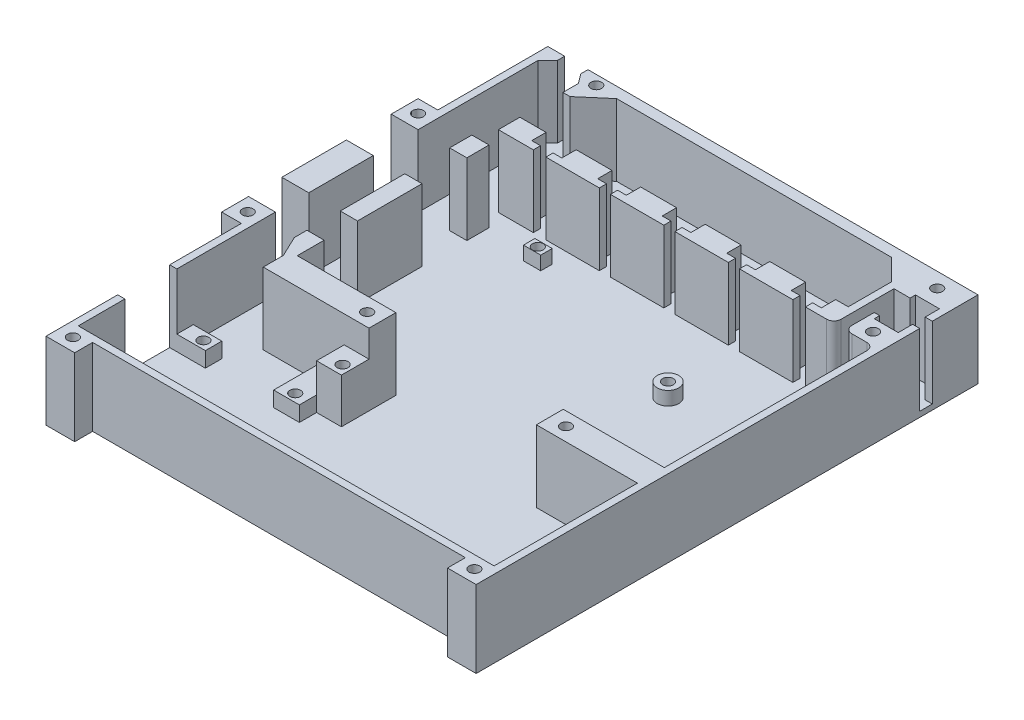
from build123d import *

# Parameters (mm, degrees)
BOSS_EXTRUDE1_DEPTH = 1.5
SKETCH2_W           = 4.8
SKETCH2_H           = 18
BOSS_EXTRUDE2_DEPTH = 20
SKETCH3_R           = 1.5
CUT_EXTRUDE1_DEPTH  = 20
SKETCH4_R           = 3
SKETCH4_R_2         = 1.5
SKETCH4_W           = 4.828517764
SKETCH4_H           = 3.2
SKETCH4_W_2         = 5.829541735
SKETCH4_H_2         = 5.702554953
SKETCH4_W_3         = 4.58984945
BOSS_EXTRUDE3_DEPTH = 3.8
SKETCH5_W           = 7.960049614
SKETCH5_H           = 4.589179968
SKETCH5_R           = 1.5
SKETCH5_W_2         = 8.506770289
SKETCH5_H_2         = 5.091999219
SKETCH5_W_3         = 7.172313144
SKETCH5_H_3         = 12.5
SKETCH5_H_4         = 13
BOSS_EXTRUDE4_DEPTH = 4.25
SKETCH6_W           = 6.917388718
SKETCH6_H           = 7.693263261
SKETCH6_R           = 1.5
SKETCH6_W_2         = 6.017640473
SKETCH6_H_2         = 7.169329529
BOSS_EXTRUDE5_DEPTH = 12.5


with BuildPart() as part:
    # Sketch1 → Boss-Extrude1 (new body)
    with BuildSketch(Plane(origin=(0, 0, 0), x_dir=(1, 0, 0), z_dir=(0, 1, 0))):
        Polygon((-60, -67.5), (-60, -72.5), (-52, -72.5), (-52, -67.5), (52, -67.5), (52, -72.5), (60, -72.5), (60, -67.5), (60, 67.5), (-60, 67.5), (-60, 36.8), (-65.5, 36.8), (-65.5, 29.3), (-60, 29.3), (-60, 16.8), (-65.5, 16.8), (-65.5, 7.8), (-65.5, -1.2), (-60, -1.2), (-60, -10.5), (-65.5, -10.5), (-65.5, -18), (-60, -18), align=None)
    extrude(amount=BOSS_EXTRUDE1_DEPTH)

    # Sketch2 → Boss-Extrude2 (add)
    with BuildSketch(Plane(origin=(0, 1.5, 0), x_dir=(1, 0, 0), z_dir=(0, 1, 0))):
        Polygon((-58, 62.8), (-58, 29.3), (-60, 29.3), (-65.5, 29.3), (-65.5, 36.8), (-60, 36.8), (-60, 67.5), (-55.3, 67.5), (-55.3, 65.5), align=None)
        with BuildLine():
            Line((-58, -65.5), (58, -65.5))
            Line((58, -65.5), (58, -25.5))
            Line((58, -25.5), (29.8, -25.5))
            Line((29.8, -25.5), (29.8, -18))
            Line((29.8, -18), (58, -18))
            Line((58, -18), (58, 38.5))
            ThreePointArc((58, 38.5), (57.414213562, 39.914213562), (56, 40.5))
            Line((56, 40.5), (51.8, 40.5))
            ThreePointArc((51.8, 40.5), (50.385786438, 41.085786438), (49.8, 42.5))
            Line((49.8, 42.5), (49.8, 48.75))
            Line((49.8, 48.75), (51.3, 48.75))
            Line((51.3, 48.75), (51.3, 47.25))
            Line((51.3, 47.25), (58, 47.25))
            Line((58, 47.25), (58, 51.25))
            Line((58, 51.25), (60, 51.25))
            Line((60, 51.25), (60, -72.5))
            Line((60, -72.5), (52, -72.5))
            Line((52, -72.5), (52, -67.5))
            Line((52, -67.5), (-52, -67.5))
            Line((-52, -67.5), (-52, -72.5))
            Line((-52, -72.5), (-60, -72.5))
            Line((-60, -72.5), (-60, -52.5))
            Line((-60, -52.5), (-58, -52.5))
            Line((-58, -52.5), (-58, -65.5))
        make_face()
        Polygon((-60, 16.8), (-58, 16.8), (-58, -1.2), (-60, -1.2), (-65.5, -1.2), (-65.5, 16.8), align=None)
        Polygon((-60, -10.5), (-58, -10.5), (-58, -38), (-60, -38), (-60, -18), (-65.5, -18), (-65.5, -10.5), align=None)
        with BuildLine():
            Line((-48.8, 67.5), (-48.8, 65.5))
            Line((-48.8, 65.5), (-46.8, 62.8))
            Line((-46.8, 62.8), (-46.8, 58.5))
            Line((-46.8, 58.5), (-44.8, 58.5))
            Line((-44.8, 58.5), (-37.8, 64.5))
            Line((-37.8, 64.5), (38.8, 64.5))
            Line((38.8, 64.5), (44.8, 58.5))
            Line((44.8, 58.5), (44.8, 46.5))
            Line((44.8, 46.5), (41.3, 46.5))
            Line((41.3, 46.5), (41.3, 42.5))
            Line((41.3, 42.5), (38.85, 42.5))
            Line((38.85, 42.5), (38.85, 40.5))
            Line((38.85, 40.5), (44.8, 40.5))
            ThreePointArc((44.8, 40.5), (46.214213562, 41.085786438), (46.8, 42.5))
            Line((46.8, 42.5), (46.8, 46.5))
            Line((46.8, 46.5), (46.8, 57.25))
            Line((46.8, 57.25), (51.3, 57.25))
            Line((51.3, 57.25), (51.3, 58.75))
            Line((51.3, 58.75), (58, 58.75))
            Line((58, 58.75), (58, 54.75))
            Line((58, 54.75), (60, 54.75))
            Line((60, 54.75), (60, 67.5))
            Line((60, 67.5), (-48.8, 67.5))
        make_face()
        Polygon((-46.8, 46.5), (-39.5, 46.5), (-39.5, 42.5), (-37.05, 42.5), (-37.05, 40.5), (-46.8, 40.5), align=None)
        Polygon((-33.55, 42.5), (-33.55, 40.5), (-18.65, 40.5), (-18.65, 42.5), (-21.1, 42.5), (-21.1, 46.5), (-31.1, 46.5), (-31.1, 42.5), align=None)
        Polygon((-15.55, 40.5), (-0.65, 40.5), (-0.65, 42.5), (-3.1, 42.5), (-3.1, 46.5), (-13.1, 46.5), (-13.1, 42.5), (-15.55, 42.5), align=None)
        Polygon((2.45, 40.5), (17.35, 40.5), (17.35, 42.5), (14.9, 42.5), (14.9, 46.5), (4.9, 46.5), (4.9, 42.5), (2.45, 42.5), align=None)
        Polygon((20.45, 40.5), (35.35, 40.5), (35.35, 42.5), (32.9, 42.5), (32.9, 46.5), (22.9, 46.5), (22.9, 42.5), (20.45, 42.5), align=None)
        Polygon((-46.8, 35.5), (-49.2, 35.5), (-49.2, 29.3), (-44.4, 29.3), (-44.4, 35.5), align=None)
        with Locations((-46.8, 7.8)):
            Rectangle(SKETCH2_W, SKETCH2_H)
        Polygon((-49.2, -10.5), (-44.4, -10.5), (-44.4, -18), (-16.9, -18), (-16.9, -25.5), (-46.4, -25.5), (-46.4, -19.9), (-49.2, -14), align=None)
    extrude(amount=BOSS_EXTRUDE2_DEPTH)

    # Sketch3 → Cut-Extrude1 (cut)
    with BuildSketch(Plane(origin=(0, 21.5, 0), x_dir=(1, 0, 0), z_dir=(0, 1, 0))):
        with Locations(Location((52.774715074, 63.354517547, 0), (0, 0, 270))):
            Circle(SKETCH3_R)
        with Locations(Location((-43.84271688, 64.854517547, 0), (0, 0, 270))):
            Circle(SKETCH3_R)
        with Locations(Location((-61.879270776, 33.191143968, 0), (0, 0, 270))):
            Circle(SKETCH3_R)
        with Locations(Location((-61.879270776, -14.337618299, 0), (0, 0, 270))):
            Circle(SKETCH3_R)
        with Locations(Location((54.274715074, 43.945098524, 0), (0, 0, 270))):
            Circle(SKETCH3_R)
        with Locations(Location((-21.029637868, -21.862387391, 0), (0, 0, 270))):
            Circle(SKETCH3_R)
        with Locations(Location((34.3, -21.75, 0), (0, 0, 270))):
            Circle(SKETCH3_R)
        with Locations(Location((-56, -69, 0), (0, 0, 270))):
            Circle(SKETCH3_R)
        with Locations(Location((56, -69, 0), (0, 0, 270))):
            Circle(SKETCH3_R)
    extrude(amount=-CUT_EXTRUDE1_DEPTH, mode=Mode.SUBTRACT)

    # Sketch4 → Boss-Extrude3 (add)
    # profile 1 of 5: a face of its own
    with BuildSketch(Plane(origin=(0, 1.5, 0), x_dir=(1, 0, 0), z_dir=(0, 1, 0))):
        with Locations(Location((21.544764921, -8.320497528, 0), (0, 0, 90))):
            Circle(SKETCH4_R)
        with Locations(Location((21.544764921, -8.320497528, 0), (0, 0, 90))):
            Circle(SKETCH4_R_2, mode=Mode.SUBTRACT)
    # profile 2 of 5: a face of its own
    with BuildSketch(Plane(origin=(0, 1.5, 0), x_dir=(1, 0, 0), z_dir=(0, 1, 0))):
        with Locations(Location((21.544764921, 19.479502472, 0), (0, 0, 90))):
            Circle(SKETCH4_R)
        with Locations(Location((21.544764921, 19.479502472, 0), (0, 0, 90))):
            Circle(SKETCH4_R_2, mode=Mode.SUBTRACT)
    # profile 3 of 5: a face of its own
    with BuildSketch(Plane(origin=(0, 1.5, 0), x_dir=(1, 0, 0), z_dir=(0, 1, 0))):
        with Locations((-29.2, 33.9)):
            Rectangle(SKETCH4_W, SKETCH4_H)
        with Locations(Location((-29.2, 33.9, 0), (0, 0, 90))):
            Circle(SKETCH4_R_2, mode=Mode.SUBTRACT)
    # profile 4 of 5: a face of its own
    with BuildSketch(Plane(origin=(0, 1.5, 0), x_dir=(1, 0, 0), z_dir=(0, 1, 0))):
        with Locations((-30.25253813, -15.148722524)):
            Rectangle(SKETCH4_W_2, SKETCH4_H_2)
        with Locations(Location((-30.3, -14.4, 0), (0, 0, 90))):
            Circle(SKETCH4_R_2, mode=Mode.SUBTRACT)
    # profile 5 of 5: a face of its own
    with BuildSketch(Plane(origin=(0, 1.5, 0), x_dir=(1, 0, 0), z_dir=(0, 1, 0))):
        with Locations((51.718864017, -15.148722524)):
            Rectangle(SKETCH4_W_3, SKETCH4_H_2)
        with Locations(Location((51.8, -14.4, 0), (0, 0, 90))):
            Circle(SKETCH4_R_2, mode=Mode.SUBTRACT)
    extrude(amount=BOSS_EXTRUDE3_DEPTH)

    # Sketch5 → Boss-Extrude4 (add)
    # profile 1 of 4: a face of its own
    with BuildSketch(Plane(origin=(0, 1.5, 0), x_dir=(1, 0, 0), z_dir=(0, 1, 0))):
        with Locations((-54.019975193, -35.705410016)):
            Rectangle(SKETCH5_W, SKETCH5_H)
        with Locations(Location((-52.773553759, -35.8, 0), (0, 0, 270))):
            Circle(SKETCH5_R, mode=Mode.SUBTRACT)
    # profile 2 of 4: a face of its own
    with BuildSketch(Plane(origin=(0, 1.5, 0), x_dir=(1, 0, 0), z_dir=(0, 1, 0))):
        with Locations((-53.746614856, -55.04599961)):
            Rectangle(SKETCH5_W_2, SKETCH5_H_2)
        with Locations(Location((-52.773553759, -54.7, 0), (0, 0, 270))):
            Circle(SKETCH5_R, mode=Mode.SUBTRACT)
    # profile 3 of 4: a face of its own
    with BuildSketch(Plane(origin=(0, 1.5, 0), x_dir=(1, 0, 0), z_dir=(0, 1, 0))):
        with Locations((-27.40354529, -31.75)):
            Rectangle(SKETCH5_W_3, SKETCH5_H_3)
        with Locations(Location((-27.173553759, -35.8, 0), (0, 0, 270))):
            Circle(SKETCH5_R, mode=Mode.SUBTRACT)
    # profile 4 of 4: a face of its own
    with BuildSketch(Plane(origin=(0, 1.5, 0), x_dir=(1, 0, 0), z_dir=(0, 1, 0))):
        with Locations((-27.40354529, -59)):
            Rectangle(SKETCH5_W_3, SKETCH5_H_4)
        with Locations(Location((-27.173553759, -54.7, 0), (0, 0, 270))):
            Circle(SKETCH5_R, mode=Mode.SUBTRACT)
    extrude(amount=BOSS_EXTRUDE4_DEPTH)

    # Sketch6 → Boss-Extrude5 (add)
    # profile 1 of 4: a face of its own
    with BuildSketch(Plane(origin=(0, 1.5, 0), x_dir=(1, 0, 0), z_dir=(0, 1, 0))):
        with Locations((-20.358694359, -29.346631631)):
            Rectangle(SKETCH6_W, SKETCH6_H)
        with Locations(Location((-19.26, -30.5, 0), (0, 0, 270))):
            Circle(SKETCH6_R, mode=Mode.SUBTRACT)
    # profile 2 of 4: a face of its own
    with BuildSketch(Plane(origin=(0, 1.5, 0), x_dir=(1, 0, 0), z_dir=(0, 1, 0))):
        with Locations((54.991179763, -29.346631631)):
            Rectangle(SKETCH6_W_2, SKETCH6_H)
        with Locations(Location((55.14, -30.5, 0), (0, 0, 270))):
            Circle(SKETCH6_R, mode=Mode.SUBTRACT)
    # profile 3 of 4: a face of its own
    with BuildSketch(Plane(origin=(0, 1.5, 0), x_dir=(1, 0, 0), z_dir=(0, 1, 0))):
        with Locations((54.991179763, -61.915335236)):
            Rectangle(SKETCH6_W_2, SKETCH6_H_2)
        with Locations(Location((55.14, -61.1, 0), (0, 0, 270))):
            Circle(SKETCH6_R, mode=Mode.SUBTRACT)
    # profile 4 of 4: a face of its own
    with BuildSketch(Plane(origin=(0, 1.5, 0), x_dir=(1, 0, 0), z_dir=(0, 1, 0))):
        with Locations((-20.358694359, -61.915335236)):
            Rectangle(SKETCH6_W, SKETCH6_H_2)
        with Locations(Location((-19.26, -61.1, 0), (0, 0, 270))):
            Circle(SKETCH6_R, mode=Mode.SUBTRACT)
    extrude(amount=BOSS_EXTRUDE5_DEPTH)


solid = part.part
